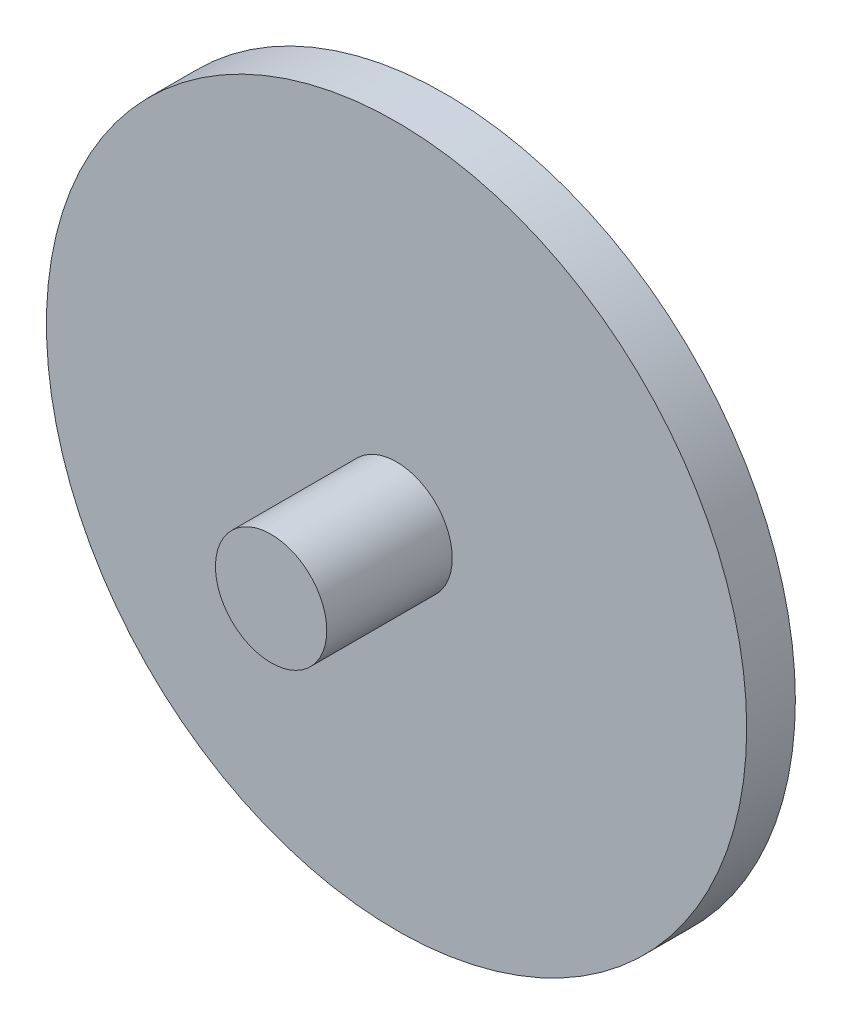
from build123d import *

# Parameters (mm, degrees)
SKETCH_1_R          = 95
EXTRUDE_1_DEPTH     = 13.208
SKETCH_2_R          = 8.820632657
SKETCH_2_R_2        = 6.280632657
CUT_EXTRUDE_1_DEPTH = 3.302
SKETCH_3_R          = 15.1013679
EXTRUDE_2_DEPTH     = 34.036


with BuildPart() as part:
    # 草图1 → 凸台-拉伸1 (new body)
    with BuildSketch(Plane.XY):
        Circle(SKETCH_1_R)
    extrude(amount=EXTRUDE_1_DEPTH)

    # 草图2 → 切除-拉伸1 (cut)
    with BuildSketch(Plane.XY.offset(13.208)):
        Circle(SKETCH_2_R)
        Circle(SKETCH_2_R_2, mode=Mode.SUBTRACT)
    extrude(amount=-CUT_EXTRUDE_1_DEPTH, mode=Mode.SUBTRACT)

    # 草图3 → 凸台-拉伸2 (add)
    with BuildSketch(Plane.XY.offset(13.208)):
        Circle(SKETCH_3_R)
    extrude(amount=EXTRUDE_2_DEPTH)


solid = part.part
